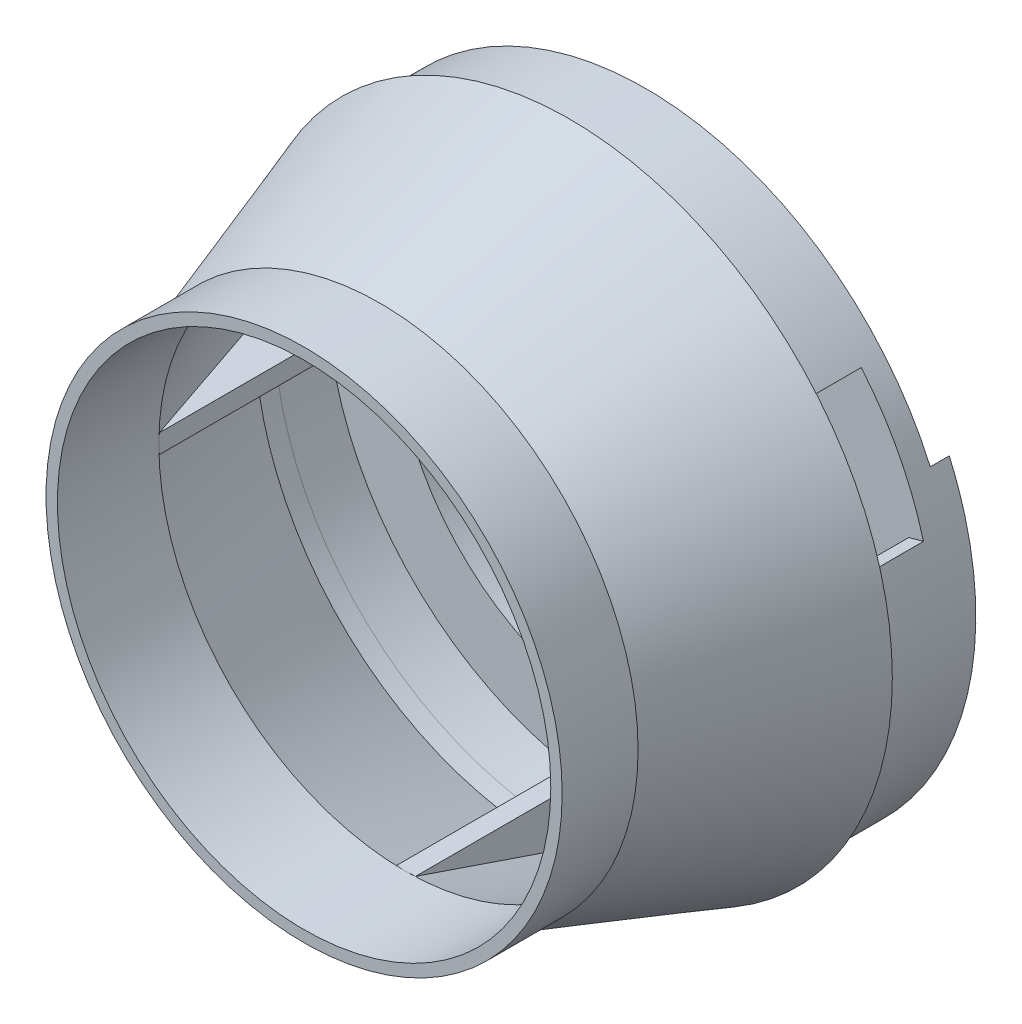
from build123d import *

# Parameters (mm, degrees)
CUT_EXTRUDE7_DEPTH   = 14
BOSS_EXTRUDE10_START = 5
BOSS_EXTRUDE10_DEPTH = 5
BOSS_EXTRUDE11_DEPTH = 2.5
CIRPATTERN1_COUNT    = 4


with BuildPart() as part:
    # Sketch10 → Revolve2 (revolve)
    with BuildSketch(Plane(origin=(0, 0, 0), x_dir=(1, 0, 0), z_dir=(0, 1, 0))):
        Polygon((68, 0), (85, 50), (82, 50), (82, 70), (60, 70), (60, 64), (78, 64), (78, 50), (78.018901629, 45), (65, 6.709112855), (65, -20), (68, -20), align=None)
    revolve(axis=Axis((0, 0, 0), (0, 0, -1)))

    # Sketch19 → Cut-Extrude7 (cut)
    with BuildSketch(Plane(origin=(0, 0, -50), x_dir=(-1, 0, 0), z_dir=(0, 0, -1))):
        with BuildLine():
            Line((-75.342214451, 20.187885518), (-79.205917756, 21.223161698))
            ThreePointArc((-79.205917756, 21.223161698), (-72.734888321, 37.863386285), (-62.815644336, 52.708583994))
            Line((-62.815644336, 52.708583994), (-59.751466563, 50.137433556))
            ThreePointArc((-59.751466563, 50.137433556), (-69.186844988, 36.016391832), (-75.342214451, 20.187885518))
        make_face()
        with BuildLine():
            Line((59.751466563, 50.137433556), (62.815644336, 52.708583994))
            ThreePointArc((62.815644336, 52.708583994), (72.734888321, 37.863386285), (79.205917756, 21.223161698))
            Line((79.205917756, 21.223161698), (75.342214451, 20.187885518))
            ThreePointArc((75.342214451, 20.187885518), (69.186844988, 36.016391832), (59.751466563, 50.137433556))
        make_face()
    extrude(amount=CUT_EXTRUDE7_DEPTH, mode=Mode.SUBTRACT)

    # Sketch29 → Boss-Extrude10 (add)
    with BuildSketch(Plane(origin=(0, 0, -70), x_dir=(-1, 0, 0), z_dir=(0, 0, -1)).offset(BOSS_EXTRUDE10_START)):
        with BuildLine():
            Line((-75, 0), (-75, 33.151168909))
            ThreePointArc((-75, 33.151168909), (0, -82), (75, 33.151168909))
            Line((75, 33.151168909), (75, 0))
            ThreePointArc((75, 0), (0, -75), (-75, 0))
        make_face()
    extrude(amount=-BOSS_EXTRUDE10_DEPTH)

    # Sketch37 → Boss-Extrude11 (add, symmetric)
    with BuildSketch(Plane(origin=(0, 0, 0), x_dir=(1, 0, 0), z_dir=(0, 1, 0))):
        Polygon((-65, 6.709112855), (-65, 70), (-78, 64), (-78.018901629, 45), align=None)
    boss_extrude11 = extrude(amount=BOSS_EXTRUDE11_DEPTH, both=True)

    # CirPattern1: Boss-Extrude11 ×4 about axis
    cirpattern1_axis = Axis((0, 0, 0), (0, 0, 1))
    for i in range(1, CIRPATTERN1_COUNT):
        add(boss_extrude11.rotate(cirpattern1_axis, i * 360 / CIRPATTERN1_COUNT))


solid = part.part
